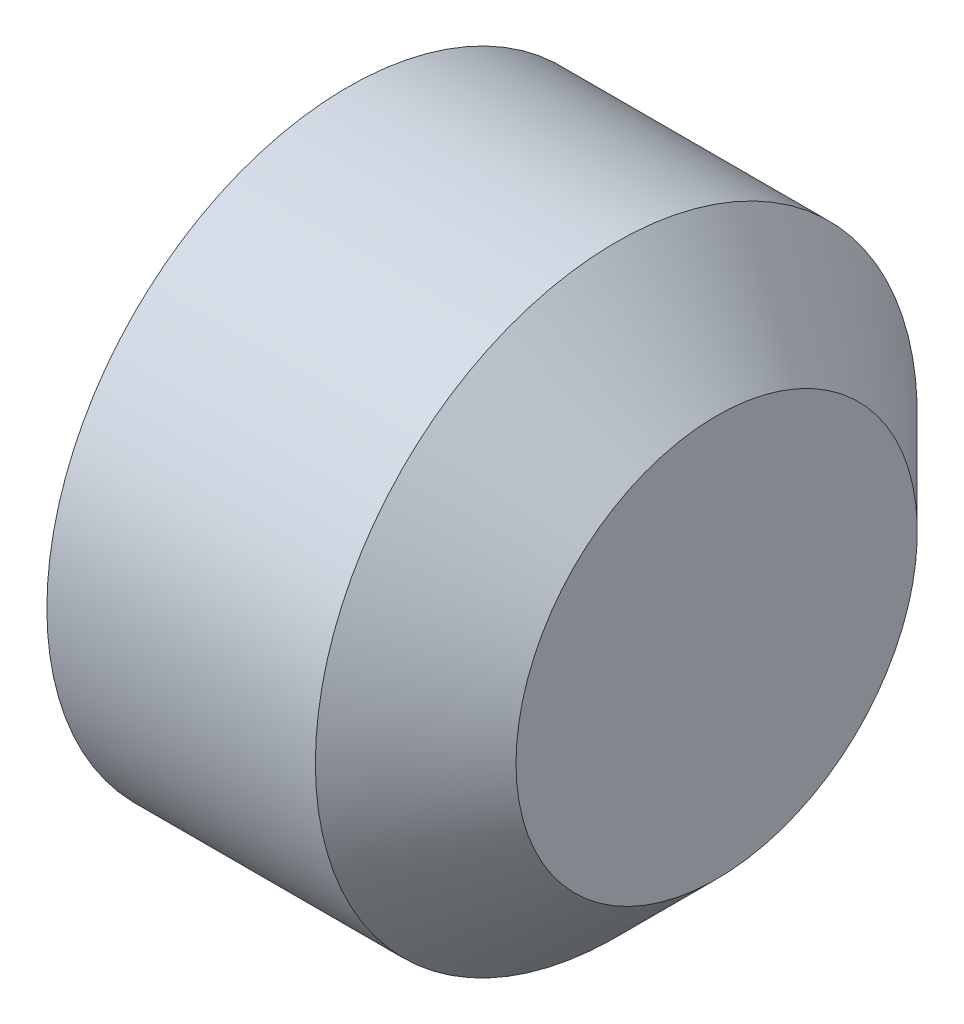
from build123d import *

# Parameters (mm, degrees)
HEX_2_DEPTH = 1.2


with BuildPart() as part:
    # BodySke → BaseBody (revolve)
    with BuildSketch(Plane.XY, mode=Mode.PRIVATE) as basebody_sk:
        Polygon((0, 0), (0, 1.2195), (0.161946751, 1.5), (1.5, 1.5), (2, 1), (2, 0), align=None)
    revolve(basebody_sk.sketch.rotate(Axis((-12.7, 0, 0), (1, 0, 0)), 90), axis=Axis((-12.7, 0, 0), (1, 0, 0)))

    # Sketch2 → Hex 2 (cut)
    with BuildSketch(Plane.ZY):
        Polygon((0.433012702, 0.75), (-0.433012702, 0.75), (-0.866025404, 0), (-0.433012702, -0.75), (0.433012702, -0.75), (0.866025404, 0), align=None)
    extrude(amount=-HEX_2_DEPTH, mode=Mode.SUBTRACT)


solid = part.part
